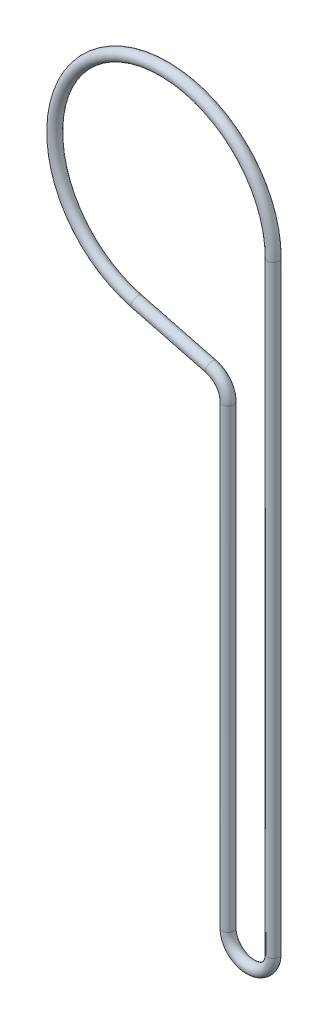
from build123d import *

# Parameters (mm, degrees)
BALAYAGE1_PROFILE_R = 1.5


with BuildPart() as part:
    # Balayage1: sweep along a path in Esquisse1
    with BuildLine(Plane.XY) as balayage1_path:
        Line((29, 0), (29, -160))
        ThreePointArc((29, -160), (23, -166), (17, -160))
        Line((17, -160), (17, -39))
        ThreePointArc((17, -39), (15.744459276, -35.327112011), (12.503297941, -33.191377504))
        Line((12.503297941, -33.191377504), (-7.265940046, -28.075008731))
        ThreePointArc((-7.265940046, -28.075008731), (-17.752291946, 22.931553167), (29, 0))
    # Balayage1 profile (on start of the path) → Balayage1 (sweep)
    with BuildSketch(Plane(origin=(29, 0, 0), x_dir=(-1, 0, 0), z_dir=(0, -1, 0))):
        Circle(BALAYAGE1_PROFILE_R)
    sweep(path=balayage1_path.line)


solid = part.part
